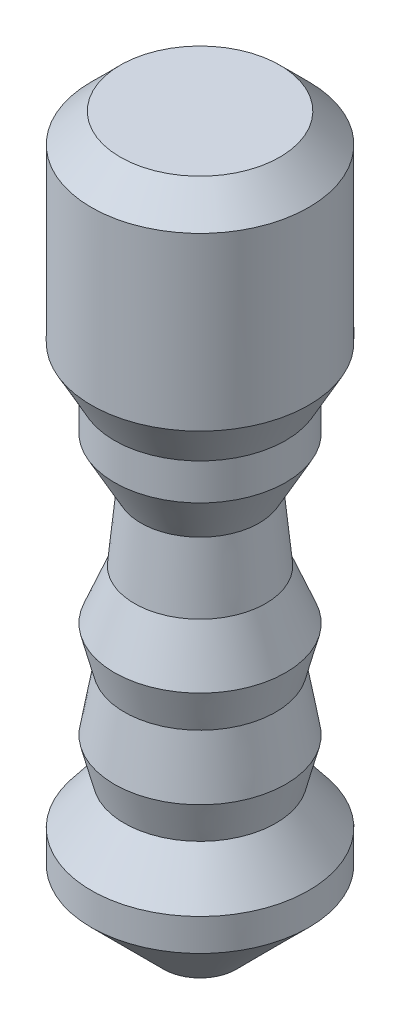
from build123d import *

# Parameters (mm, degrees)
SKETCH1_R           = 7.5
BOSS_EXTRUDE1_DEPTH = 50
CHAMFER1_SIZE       = 5
CHAMFER2_SIZE       = 2


with BuildPart() as part:
    # Sketch1 → Boss-Extrude1 (new body)
    with BuildSketch(Plane(origin=(0, 0, 0), x_dir=(1, 0, 0), z_dir=(0, 1, 0))):
        with Locations(Location((0, 0, 0), (0, 0, 270))):
            Circle(SKETCH1_R)
    extrude(amount=BOSS_EXTRUDE1_DEPTH)

    # Chamfer1
    chamfer1_edges = [part.edges().sort_by_distance(p)[0] for p in [
        (0, 0, -7.5),
    ]]
    chamfer(chamfer1_edges, length=CHAMFER1_SIZE)

    # Chamfer2
    chamfer2_edges = [part.edges().sort_by_distance(p)[0] for p in [
        (0, 50, -7.5),
    ]]
    chamfer(chamfer2_edges, length=CHAMFER2_SIZE)

    # Sketch2 → Cut-Revolve1 (revolve, cut)
    with BuildSketch(Plane.XY, mode=Mode.PRIVATE) as cut_revolve1_sk:
        Polygon((7.5, 36.190061777), (5.908616691, 33.28526698), (5.908616691, 30.776580564), (4.081049732, 27.440673393), (4.522237355, 22.854412934), (5.908616691, 19.421473627), (5.215427023, 16.71473302), (5.908616691, 12.753649205), (5.22558542, 10.08657472), (7.5, 7.208131864), (18.320012644, 16.71473302), align=None)
    revolve(cut_revolve1_sk.sketch.rotate(Axis((0, 0, 0), (0, 1, 0)), 90), axis=Axis((0, 0, 0), (0, 1, 0)), mode=Mode.SUBTRACT)


solid = part.part
